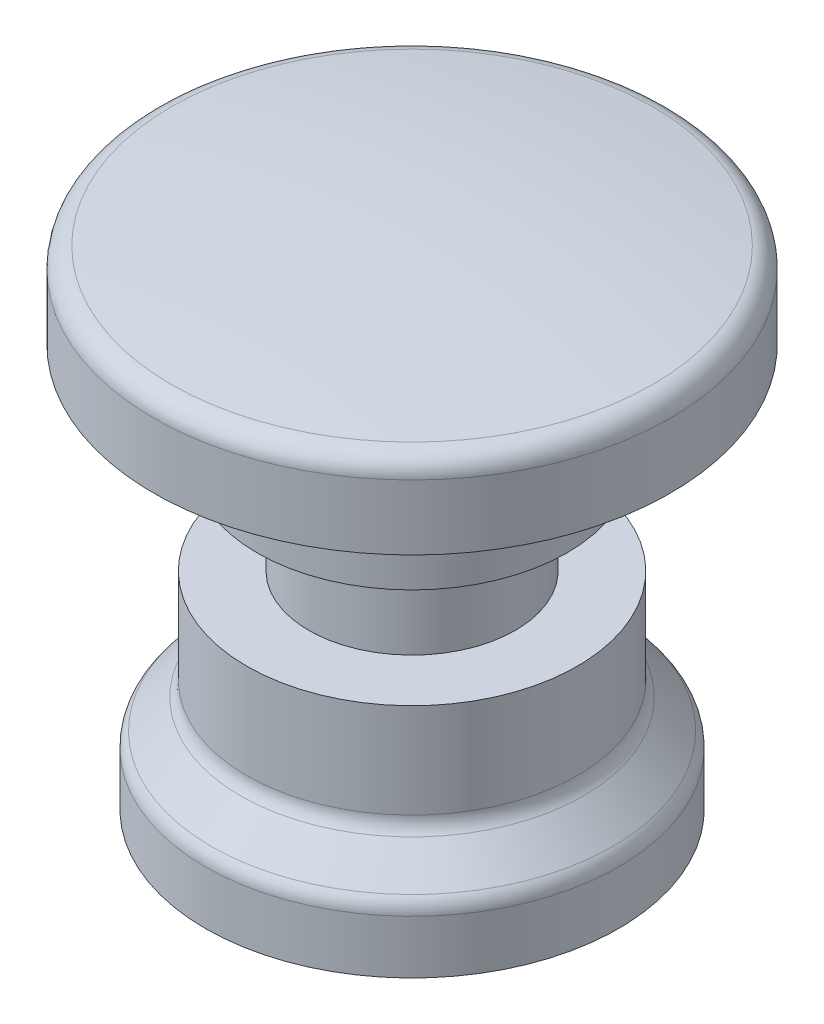
from build123d import *

# Parameters (mm, degrees)
DOME1_FACE_RADIUS = 12.5
DOME1_HEIGHT      = 1
FILLET1_R         = 1


with BuildPart() as part:
    # Sketch1 → Revolve1 (revolve)
    with BuildSketch(Plane.XY, mode=Mode.PRIVATE) as revolve1_sk:
        Polygon((0, 23.5), (12.5, 23.5), (12.5, 19.5), (7.5, 19.5), (7.5, 14.5), (5, 14.5), (5, 10), (8, 10), (8, 5), (10, 3), (10, 0), (0, 0), align=None)
    revolve(revolve1_sk.sketch.rotate(Axis((0, 0, 0), (0, 1, 0)), 90), axis=Axis((0, 0, 0), (0, 1, 0)))

    # Dome1: a dome of height H over a round flat face of radius A is a cap of a sphere of radius (A * A + H * H) / (2 * H)
    dome1_r = (DOME1_FACE_RADIUS * DOME1_FACE_RADIUS + DOME1_HEIGHT * DOME1_HEIGHT) / (2 * DOME1_HEIGHT)
    dome1_base = Plane((0, 23.5, 0), z_dir=(0, 1, 0))
    with Locations(dome1_base.offset(DOME1_HEIGHT - dome1_r)):
        dome1_ball = Sphere(dome1_r, mode=Mode.PRIVATE)
    add(split(dome1_ball, bisect_by=dome1_base, keep=Keep.TOP, mode=Mode.PRIVATE))

    # Fillet1
    fillet1_edges = [part.edges().sort_by_distance(p)[0] for p in [
        (12.5, 23.5, 0),
        (0, 3, 10),
        (0, 5, 8),
    ]]
    fillet(fillet1_edges, radius=FILLET1_R)


solid = part.part
